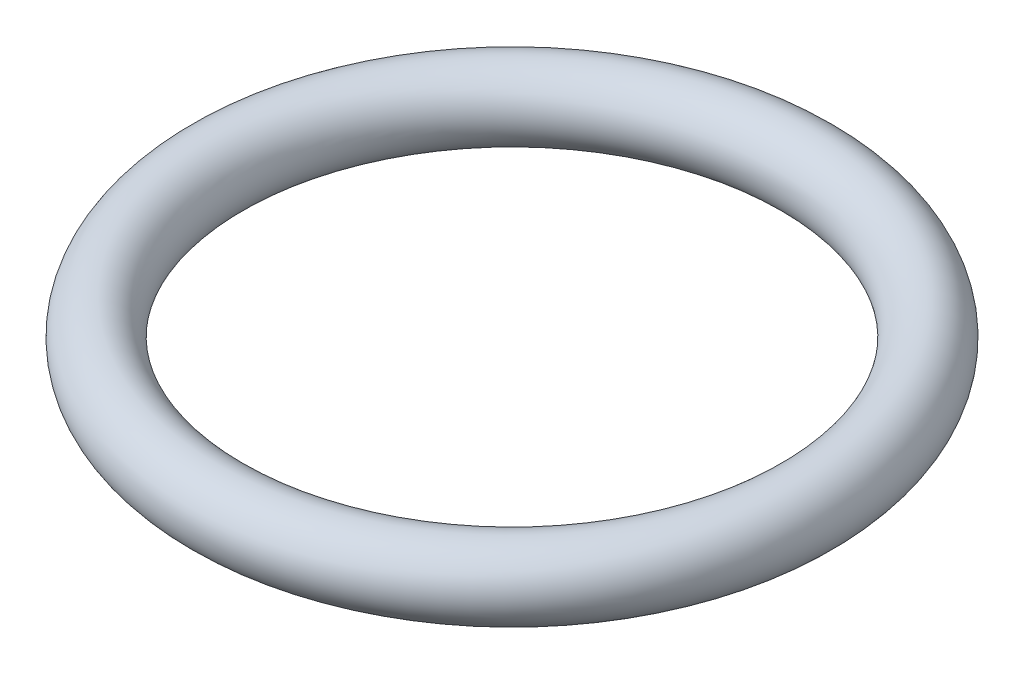
from build123d import *

# Parameters (mm, degrees)
SWEEP_1_PROFILE_R = 1.325


with BuildPart() as part:
    # 扫描1: sweep along a path in 草图1
    with BuildLine(Plane(origin=(0, 0, 0), x_dir=(1, 0, 0), z_dir=(0, 1, 0))) as sweep_1_path:
        CenterArc((0, 0), 11, 0, 360)
    # 扫描1 profile (on start of the path) → 扫描1 (sweep)
    with BuildSketch(Plane(origin=(11, 0, 0), x_dir=(-1, 0, 0), z_dir=(0, 0, -1))):
        Circle(SWEEP_1_PROFILE_R)
    sweep(path=sweep_1_path.line)


solid = part.part
